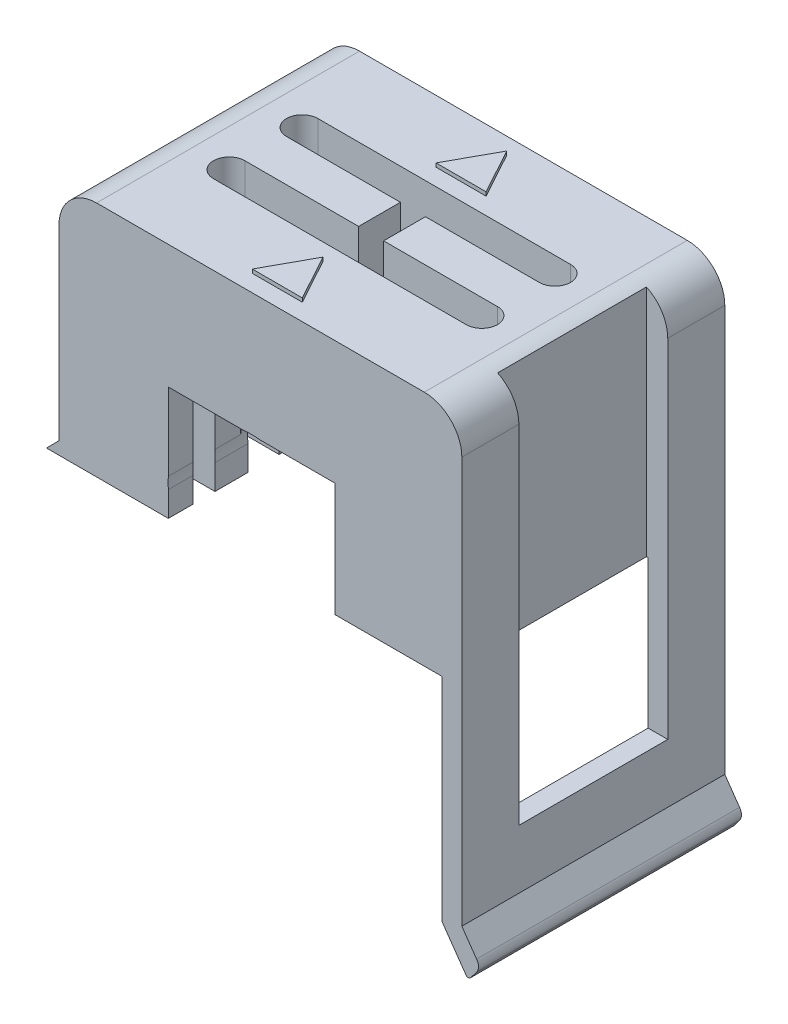
from build123d import *

# Parameters (mm, degrees)
SALIENTE_EXTRUIR1_DEPTH = 21.02
CORTAR_EXTRUIR1_DEPTH   = 48.423848102
SALIENTE_EXTRUIR2_DEPTH = 0.3
CORTAR_EXTRUIR2_DEPTH   = 1.7
CROQUIS6_W              = 13.32
CROQUIS6_H              = 9.1
CORTAR_EXTRUIR3_DEPTH   = 5.78
CROQUIS7_W              = 13.32
CROQUIS7_H              = 9.1
CORTAR_EXTRUIR4_DEPTH   = 5.78
CROQUIS8_W              = 21.89
CROQUIS8_H              = 1.74582909
CORTAR_EXTRUIR5_DEPTH   = 15.76


with BuildPart() as part:
    # Croquis2 → Saliente-Extruir1 (new body)
    with BuildSketch(Plane.XY):
        with BuildLine():
            Line((16.1, -25.6), (16.1, -9.1))
            Line((16.1, -9.1), (16.1, 6.87))
            ThreePointArc((16.1, 6.87), (15.221320344, 8.991320344), (13.1, 9.87))
            Line((13.1, 9.87), (-13.1, 9.87))
            ThreePointArc((-13.1, 9.87), (-15.221320344, 8.991320344), (-16.1, 6.87))
            Line((-16.1, 6.87), (-16.1, -8.084842917))
            Line((-16.1, -8.084842917), (-17.1, -9.1))
            Line((-17.1, -9.1), (-16.1, -9.1))
            Line((-16.1, -9.1), (-7.36, -9.1))
            Line((-7.36, -9.1), (-7.36, -7.1))
            ThreePointArc((-7.36, -7.1), (-0.7, 0.036800452), (5.96, -7.1))
            Line((5.96, -7.1), (5.96, -9.1))
            Line((5.96, -9.1), (14.53, -9.1))
            Line((14.53, -9.1), (14.53, -26.095019099))
            Line((14.53, -26.095019099), (16.46294155, -28.855545721))
            ThreePointArc((16.46294155, -28.855545721), (16.646307517, -28.898064095), (16.810355034, -28.805764032))
            Line((16.810355034, -28.805764032), (16.821593757, -28.791058008))
            Line((16.821593757, -28.791058008), (17.28495009, -28.184749839))
            ThreePointArc((17.28495009, -28.184749839), (17.43599966, -27.735907903), (17.281999232, -27.288069848))
            Line((17.281999232, -27.288069848), (16.1, -25.6))
        make_face()
    extrude(amount=SALIENTE_EXTRUIR1_DEPTH)

    # Croquis3 → Cortar-Extruir1 (cut, through all)
    with BuildSketch(Plane(origin=(0, 9.87, 0), x_dir=(1, 0, 0), z_dir=(0, 1, 0))):
        with BuildLine():
            Line((-10.1, -12.17), (-1, -12.17))
            Line((-1, -12.17), (-1, -8.83))
            Line((-1, -8.83), (-10.1, -8.83))
            ThreePointArc((-10.1, -8.83), (-11.35, -7.58), (-10.1, -6.33))
            Line((-10.1, -6.33), (10.1, -6.33))
            ThreePointArc((10.1, -6.33), (11.35, -7.58), (10.1, -8.83))
            Line((10.1, -8.83), (1, -8.83))
            Line((1, -8.83), (1, -12.17))
            Line((1, -12.17), (10.1, -12.17))
            ThreePointArc((10.1, -12.17), (11.35, -13.42), (10.1, -14.67))
            Line((10.1, -14.67), (-10.1, -14.67))
            ThreePointArc((-10.1, -14.67), (-11.35, -13.42), (-10.1, -12.17))
        make_face()
    extrude(amount=-CORTAR_EXTRUIR1_DEPTH, mode=Mode.SUBTRACT)

    # Croquis4 → Saliente-Extruir2 (add)
    with BuildSketch(Plane(origin=(0, 9.87, 0), x_dir=(-1, 0, 0), z_dir=(0, 1, 0))):
        Polygon((0, 16.02), (2, 19.67), (-2, 19.67), align=None)
        Polygon((2, 4.98), (-2, 4.98), (0, 1.33), align=None)
    extrude(amount=SALIENTE_EXTRUIR2_DEPTH)

    # Croquis5 → Cortar-Extruir2 (cut)
    with BuildSketch(Plane(origin=(16.1, 0, 0), x_dir=(0, 0, -1), z_dir=(1, 0, 0))):
        Polygon((-16.46, 6.87), (-16.46, -20.9), (-10.51, -20.9), (-4.56, -20.9), (-4.56, 6.87), align=None)
        Polygon((-16.46, 9.815378902), (-16.46, 6.87), (-4.56, 6.87), (-4.56, 10.17), align=None)
    extrude(amount=-CORTAR_EXTRUIR2_DEPTH, mode=Mode.SUBTRACT)

    # Croquis6 → Cortar-Extruir3 (cut)
    with BuildSketch(Plane(origin=(0, 0, 0), x_dir=(-1, 0, 0), z_dir=(0, 0, -1))):
        with Locations((0.7, -4.55)):
            Rectangle(CROQUIS6_W, CROQUIS6_H)
    extrude(amount=-CORTAR_EXTRUIR3_DEPTH, mode=Mode.SUBTRACT)

    # Croquis7 → Cortar-Extruir4 (cut)
    with BuildSketch(Plane.XY.offset(21.02)):
        with Locations((-0.7, -4.55)):
            Rectangle(CROQUIS7_W, CROQUIS7_H)
    extrude(amount=-CORTAR_EXTRUIR4_DEPTH, mode=Mode.SUBTRACT)

    # Croquis8 → Cortar-Extruir5 (cut)
    with BuildSketch(Plane.XZ.offset(9.1)):
        Polygon((-7.36, 19.04), (-9.552269286, 19.04), (-15.51, 19.04), (-15.51, 17.29417091), (-9.552269286, 17.29417091), (-7.36, 17.29417091), align=None)
        with Locations((3.585, 18.167085455)):
            Rectangle(CROQUIS8_W, CROQUIS8_H)
        with Locations((3.585, 2.832914545)):
            Rectangle(CROQUIS8_W, CROQUIS8_H)
        Polygon((-15.51, 3.70582909), (-15.51, 1.96), (-9.552269286, 1.96), (-7.36, 1.96), (-7.36, 3.70582909), (-9.552269286, 3.70582909), align=None)
    extrude(amount=-CORTAR_EXTRUIR5_DEPTH, mode=Mode.SUBTRACT)


solid = part.part
